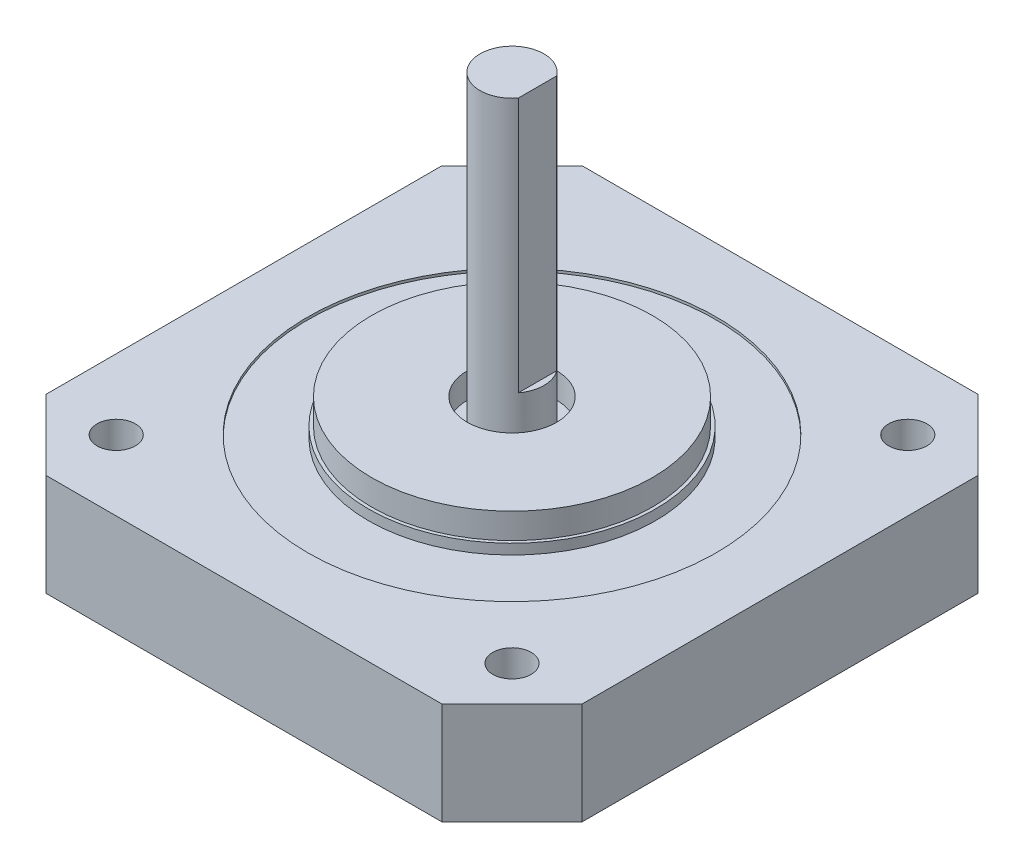
from build123d import *

# Parameters (mm, degrees)
SKETCH1_W           = 42
SKETCH1_H           = 42
NEMA_17_DEPTH       = 8
CHAMFER1_SIZE       = 5.5
SKETCH2_R           = 1.5
M6_BOLT_HOLES_DEPTH = 31.757112998
SKETCH3_R           = 16
CUT_EXTRUDE1_DEPTH  = 0.2
SKETCH4_R           = 11.25
BOSS_EXTRUDE1_DEPTH = 0.8
SKETCH5_R           = 11
BOSS_EXTRUDE2_DEPTH = 2
SKETCH6_R           = 3.5
CUT_EXTRUDE2_DEPTH  = 31.918602814
SKETCH7_R           = 2.5
BOSS_EXTRUDE3_DEPTH = 24
CUT_EXTRUDE3_START  = -20
CUT_EXTRUDE3_DEPTH  = 20


with BuildPart() as part:
    # Sketch1 → Nema 17 (new body)
    with BuildSketch(Plane(origin=(0, 0, 0), x_dir=(1, 0, 0), z_dir=(0, 1, 0))):
        Rectangle(SKETCH1_W, SKETCH1_H)
    extrude(amount=NEMA_17_DEPTH)

    # Chamfer1
    chamfer1_edges = [part.edges().sort_by_distance(p)[0] for p in [
        (21, 4, 21),
        (-21, 4, 21),
        (-21, 4, -21),
        (21, 4, -21),
    ]]
    chamfer(chamfer1_edges, length=CHAMFER1_SIZE)

    # Sketch2 → M6 Bolt Holes (cut, through all)
    with BuildSketch(Plane.XZ):
        with Locations(Location((-15.5, -15.5, 0), (0, 0, 270))):
            Circle(SKETCH2_R)
        with Locations(Location((15.5, -15.5, 0), (0, 0, 90))):
            Circle(SKETCH2_R)
        with Locations(Location((-15.5, 15.5, 0), (0, 0, 90))):
            Circle(SKETCH2_R)
        with Locations(Location((15.5, 15.5, 0), (0, 0, 270))):
            Circle(SKETCH2_R)
    extrude(amount=-M6_BOLT_HOLES_DEPTH, mode=Mode.SUBTRACT)

    # Sketch3 → Cut-Extrude1 (cut)
    with BuildSketch(Plane(origin=(0, 8, 0), x_dir=(1, 0, 0), z_dir=(0, 1, 0))):
        with Locations(Location((0, 0, 0), (0, 0, 270))):
            Circle(SKETCH3_R)
    extrude(amount=-CUT_EXTRUDE1_DEPTH, mode=Mode.SUBTRACT)

    # Sketch4 → Boss-Extrude1 (add)
    with BuildSketch(Plane(origin=(0, 7.8, 0), x_dir=(1, 0, 0), z_dir=(0, 1, 0))):
        with Locations(Location((0, 0, 0), (0, 0, 270))):
            Circle(SKETCH4_R)
    extrude(amount=BOSS_EXTRUDE1_DEPTH)

    # Sketch5 → Boss-Extrude2 (add)
    with BuildSketch(Plane(origin=(0, 8.6, 0), x_dir=(1, 0, 0), z_dir=(0, 1, 0))):
        with Locations(Location((0, 0, 0), (0, 0, 270))):
            Circle(SKETCH5_R)
    extrude(amount=BOSS_EXTRUDE2_DEPTH)

    # Sketch6 → Cut-Extrude2 (cut, through all)
    with BuildSketch(Plane(origin=(0, 8.6, 0), x_dir=(1, 0, 0), z_dir=(0, 1, 0))):
        with Locations(Location((0, 0, 0), (0, 0, 270))):
            Circle(SKETCH6_R)
    extrude(amount=CUT_EXTRUDE2_DEPTH, mode=Mode.SUBTRACT)

    # Sketch7 → Boss-Extrude3 (add)
    with BuildSketch(Plane(origin=(0, 8.6, 0), x_dir=(1, 0, 0), z_dir=(0, 1, 0))):
        with Locations(Location((0, 0, 0), (0, 0, 270))):
            Circle(SKETCH7_R)
    extrude(amount=BOSS_EXTRUDE3_DEPTH)

    # Sketch9 → Cut-Extrude3 (cut)
    with BuildSketch(Plane(origin=(0, 32.6, 0), x_dir=(1, 0, 0), z_dir=(0, 1, 0)).offset(CUT_EXTRUDE3_START)):
        with BuildLine():
            Line((2, 1.5), (2, -1.5))
            ThreePointArc((2, -1.5), (2.5, 0), (2, 1.5))
        make_face()
    extrude(amount=CUT_EXTRUDE3_DEPTH, mode=Mode.SUBTRACT)


solid = part.part
